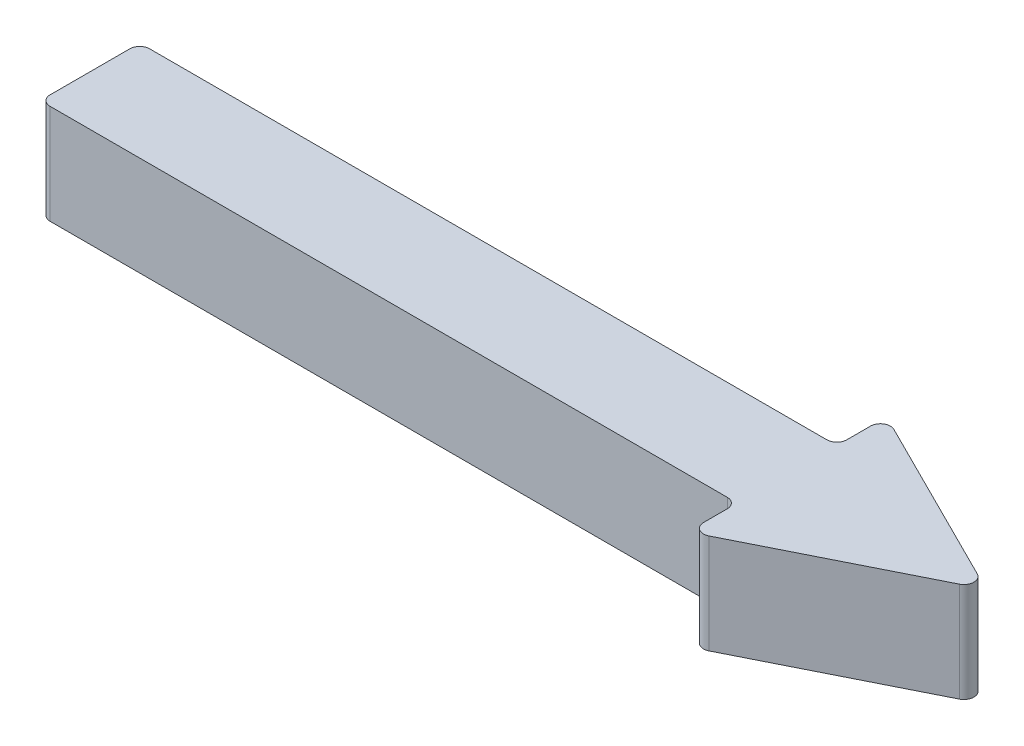
from build123d import *

# Parameters (mm, degrees)
SKETCH1_W           = 44.45
SKETCH1_H           = 3.175
BOSS_EXTRUDE1_DEPTH = 6.35
SKETCH2_R           = 2.4003
CUT_EXTRUDE1_DEPTH  = 8.89
FILLET1_R           = 0.635
SKETCH4_R           = 0.889
CUT_EXTRUDE2_DEPTH  = 3.81


with BuildPart() as part:
    # Sketch1 → Boss-Extrude1 (new body)
    with BuildSketch(Plane(origin=(0, 0, 0), x_dir=(1, 0, 0), z_dir=(0, 1, 0))):
        with Locations((22.225, 4.7625)):
            Rectangle(SKETCH1_W, SKETCH1_H)
        with Locations((22.225, 1.5875)):
            Rectangle(SKETCH1_W, SKETCH1_H)
        Polygon((44.45, 6.35), (44.45, 3.175), (57.15, 3.175), (44.45, 9.525), align=None)
        Polygon((57.15, 3.175), (44.45, 3.175), (44.45, 0), (44.45, -3.175), align=None)
    extrude(amount=BOSS_EXTRUDE1_DEPTH)

    # Sketch2 → Cut-Extrude1 (cut)
    with BuildSketch(Plane.ZY):
        with Locations((-3.175, 3.175)):
            Circle(SKETCH2_R)
    extrude(amount=-CUT_EXTRUDE1_DEPTH, mode=Mode.SUBTRACT)

    # Fillet1
    fillet1_edges = [part.edges().sort_by_distance(p)[0] for p in [
        (0, 3.175, -6.35),
        (44.45, 3.175, -6.35),
        (44.45, 3.175, -9.525),
        (57.15, 3.175, -3.175),
        (44.45, 3.175, 3.175),
        (44.45, 3.175, 0),
        (0, 3.175, 0),
    ]]
    fillet(fillet1_edges, radius=FILLET1_R)

    # Sketch4 → Cut-Extrude2 (cut)
    with BuildSketch(Plane.XZ):
        with Locations(Location((20.562548417, -3.175, 0), (0, 0, 270))):
            Circle(SKETCH4_R)
        with Locations(Location((35.802548417, -3.175, 0), (0, 0, 270))):
            Circle(SKETCH4_R)
    extrude(amount=-CUT_EXTRUDE2_DEPTH, mode=Mode.SUBTRACT)


solid = part.part
